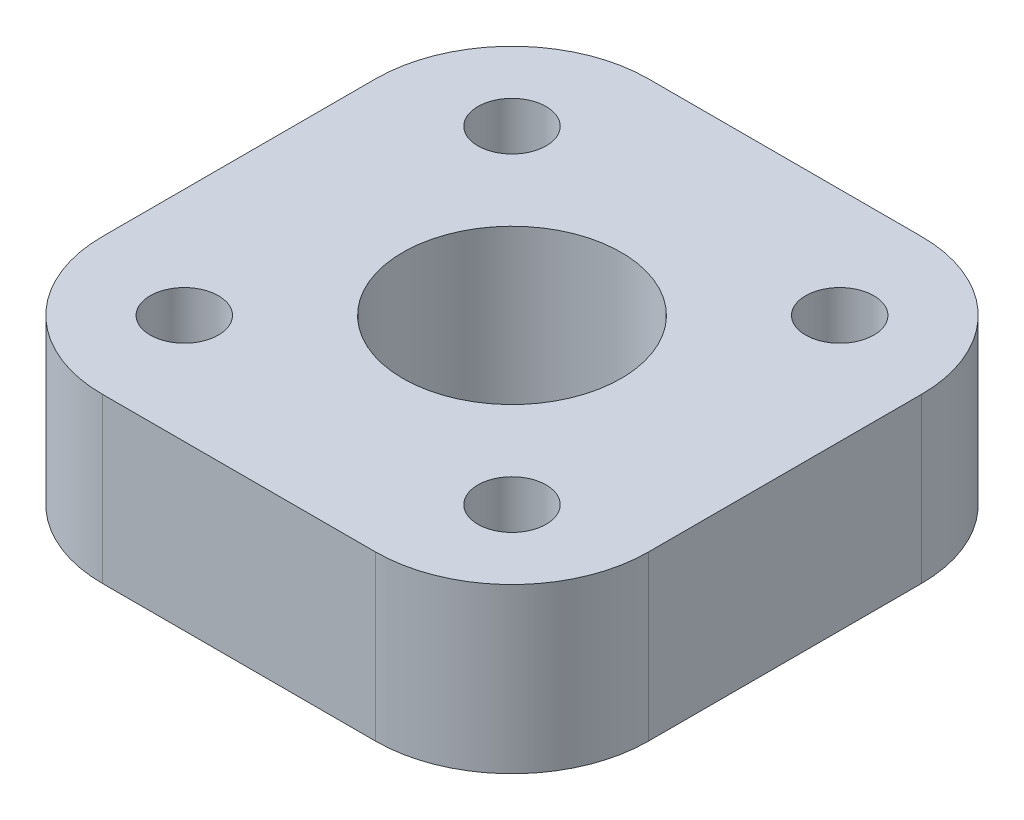
from build123d import *

# Parameters (mm, degrees)
CROQUIS1_W                = 20
CROQUIS1_H                = 20
CROQUIS1_R                = 4
SALIENTE_EXTRUIR1_DEPTH   = 3
TALADRO_ROSCADO_M3X0_52_D = 2.5
REDONDEO1_R               = 5


with BuildPart() as part:
    # Croquis1 → Saliente-Extruir1 (new, symmetric)
    with BuildSketch(Plane(origin=(0, 0, 0), x_dir=(1, 0, 0), z_dir=(0, 1, 0))):
        Rectangle(CROQUIS1_W, CROQUIS1_H)
        with Locations(Location((0, 0, 0), (0, 0, 270))):
            Circle(CROQUIS1_R, mode=Mode.SUBTRACT)
    extrude(amount=SALIENTE_EXTRUIR1_DEPTH, both=True)

    # Taladro roscado M3x0.52 (through all)
    with Locations(Plane(origin=(0, 3, 0), x_dir=(1, 0, 0), z_dir=(0, 1, 0))):
        with Locations((6, 6), (-6, 6), (-6, -6), (6, -6)):
            Hole(TALADRO_ROSCADO_M3X0_52_D / 2)

    # Redondeo1
    redondeo1_edges = [part.edges().sort_by_distance(p)[0] for p in [
        (10, 0, 10),
        (-10, 0, 10),
        (-10, 0, -10),
        (10, 0, -10),
    ]]
    fillet(redondeo1_edges, radius=REDONDEO1_R)


solid = part.part
